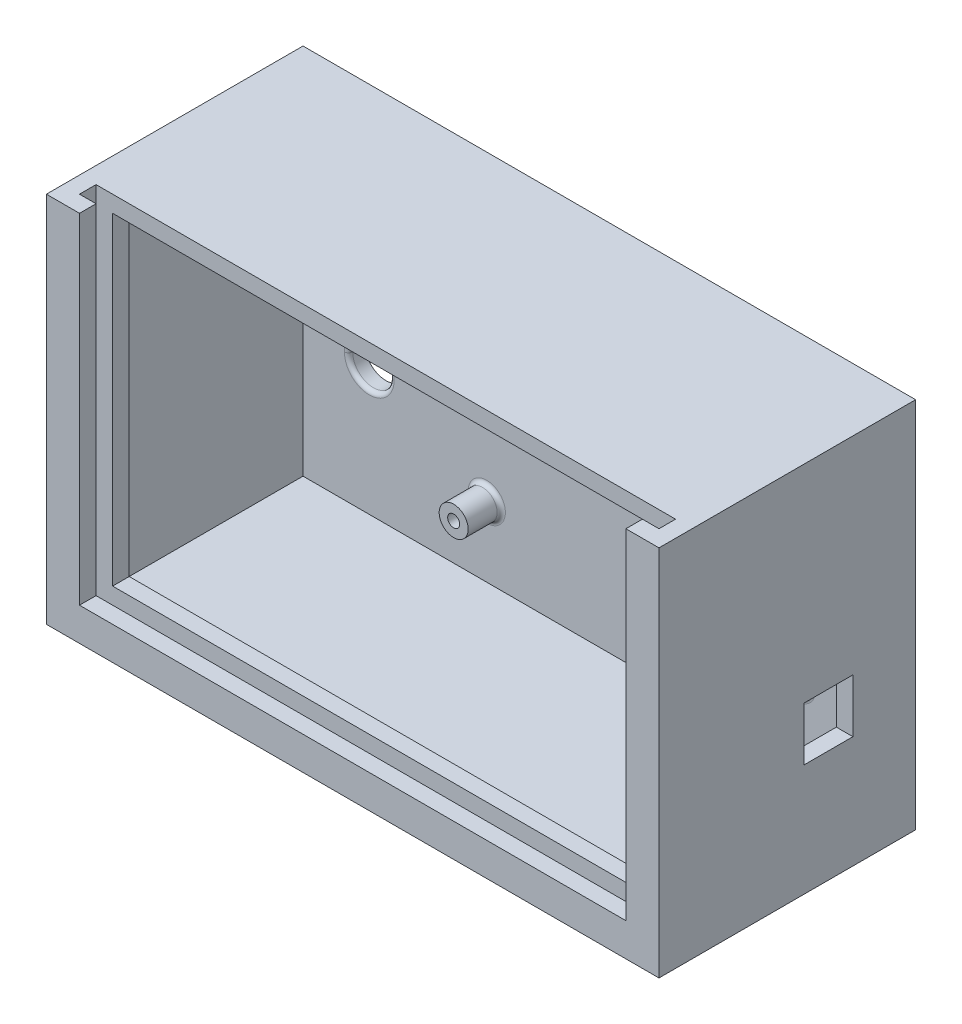
from build123d import *

# Parameters (mm, degrees)
SKETCH1_W                = 148
SKETCH1_H                = 90
BOSS_EXTRUDE1_DEPTH      = 4
SKETCH2_R                = 4
CUT_EXTRUDE1_DEPTH       = 4
SKETCH3_R                = 3.5
SKETCH3_R_2              = 1.45
SKETCH3_R_3              = 3.219945731
BOSS_EXTRUDE2_DEPTH      = 8
CUT_EXTRUDE2_DEPTH       = 10
SKETCH8_W                = 148
SKETCH8_H                = 90
SKETCH8_W_2              = 140
SKETCH8_H_2              = 82
BOSS_EXTRUDE3_DEPTH      = 50
FILLET1_R                = 1
BOSS_EXTRUDE4_DEPTH      = 8
BOSS_EXTRUDE4_DEPTH_BACK = 4
CUT_EXTRUDE3_REACH       = 133.985
SKETCH10_W               = 140
SKETCH10_H               = 4
CUT_EXTRUDE4_REACH       = 165.11
SKETCH11_W               = 11.795
SKETCH11_H               = 12.938


with BuildPart() as part:
    # Sketch1 → Boss-Extrude1 (new body)
    with BuildSketch(Plane.XY):
        Rectangle(SKETCH1_W, SKETCH1_H)
    extrude(amount=BOSS_EXTRUDE1_DEPTH)

    # Sketch2 → Cut-Extrude1 (cut)
    with BuildSketch(Plane.XY.offset(4)):
        with Locations((54, 0)):
            Circle(SKETCH2_R)
        with Locations((14, 0)):
            Circle(SKETCH2_R)
    extrude(amount=-CUT_EXTRUDE1_DEPTH, mode=Mode.SUBTRACT)

    # Sketch3 → Boss-Extrude2 (add)
    # profile 1 of 4: a face of its own
    with BuildSketch(Plane.XY.offset(4)):
        with Locations(Location((-33.0986, 24.1681, 0), (0, 0, 180))):
            Circle(SKETCH3_R)
        with Locations((-33.0986, 24.1681)):
            Circle(SKETCH3_R_2, mode=Mode.SUBTRACT)
    # profile 2 of 4: a face of its own
    with BuildSketch(Plane.XY.offset(4)):
        with Locations(Location((49.5276, 24.1681, 0), (0, 0, 180))):
            Circle(SKETCH3_R)
        with Locations((49.5276, 24.1681)):
            Circle(SKETCH3_R_2, mode=Mode.SUBTRACT)
    # profile 3 of 4: a face of its own
    with BuildSketch(Plane.XY.offset(4)):
        with Locations(Location((-25.6056, -24.1681, 0), (0, 0, 180))):
            Circle(SKETCH3_R)
        with Locations((-25.6056, -24.1681)):
            Circle(SKETCH3_R_2, mode=Mode.SUBTRACT)
    # profile 4 of 4: a face of its own
    with BuildSketch(Plane.XY.offset(4)):
        with Locations(Location((49.5276, -24.1681, 0), (0, 0, 180))):
            Circle(SKETCH3_R_3)
        with Locations((49.5276, -24.1681)):
            Circle(SKETCH3_R_2, mode=Mode.SUBTRACT)
    extrude(amount=BOSS_EXTRUDE2_DEPTH)

    # Sketch7 → Cut-Extrude2 (cut)
    with BuildSketch(Plane.XY.offset(4)):
        with BuildLine():
            Line((-59, -10), (-59, 10))
            ThreePointArc((-59, 10), (-54, 15), (-49, 10))
            Line((-49, 10), (-49, -10))
            ThreePointArc((-49, -10), (-54, -15), (-59, -10))
        make_face()
    extrude(amount=-CUT_EXTRUDE2_DEPTH, mode=Mode.SUBTRACT)

    # Sketch8 → Boss-Extrude3 (add)
    with BuildSketch(Plane.XY.offset(4)):
        Rectangle(SKETCH8_W, SKETCH8_H)
        Rectangle(SKETCH8_W_2, SKETCH8_H_2, mode=Mode.SUBTRACT)
    extrude(amount=BOSS_EXTRUDE3_DEPTH)

    # Fillet1
    fillet1_edges = [part.edges().sort_by_distance(p)[0] for p in [
        (-29.5986, 24.1681, 4),
        (53.0276, 24.1681, 4),
        (-22.1056, -24.1681, 4),
        (52.747545731, -24.1681, 4),
        (-54, -15, 4),
        (-49, 0, 4),
        (-54, 15, 4),
        (-59, 0, 4),
    ]]
    fillet(fillet1_edges, radius=FILLET1_R)

    # Sketch9 → Boss-Extrude4 (add, two sides: drawn at the far end of the back side and taken through both)
    with BuildSketch(Plane.XY.offset(54).offset(-BOSS_EXTRUDE4_DEPTH_BACK)):
        Polygon((-74, 45), (-66, 45), (-66, -37), (66, -37), (66, 45), (74, 45), (74, -45), (66, -45), (-66, -45), (-74, -45), align=None)
    extrude(amount=BOSS_EXTRUDE4_DEPTH + BOSS_EXTRUDE4_DEPTH_BACK)

    # Cut-Extrude3: up to this face of the body (flat: up to its plane)
    cut_extrude3_end = Plane(part.part.faces().sort_by_distance((0, -41, 27))[0])
    # Sketch10 → Cut-Extrude3 (cut, up to the picked face)
    with BuildSketch(Plane(origin=(0, 45, 0), x_dir=(1, 0, 0), z_dir=(0, 1, 0)), mode=Mode.PRIVATE) as cut_extrude3_sk1:
        with Locations((0, -56)):
            Rectangle(SKETCH10_W, SKETCH10_H)
    cut_extrude3_tool1 = split(extrude(cut_extrude3_sk1.sketch, amount=-CUT_EXTRUDE3_REACH, mode=Mode.PRIVATE), bisect_by=cut_extrude3_end, keep=Keep.BOTH, mode=Mode.PRIVATE)
    add(cut_extrude3_tool1.solids().sort_by(Axis((0, 45, 56), (0, -1, 0)))[0], mode=Mode.SUBTRACT)

    # Sketch11 → Cut-Extrude4 (cut, up to next)
    with BuildSketch(Plane.ZY.offset(-70), mode=Mode.PRIVATE) as cut_extrude4_sk1:
        with Locations((21.0485, -11.4681)):
            Rectangle(SKETCH11_W, SKETCH11_H)
    cut_extrude4_tool1 = extrude(cut_extrude4_sk1.sketch, amount=-CUT_EXTRUDE4_REACH, mode=Mode.PRIVATE) & part.part
    add(cut_extrude4_tool1.solids().sort_by_distance((70, -11.4681, 21.0485))[0], mode=Mode.SUBTRACT)


solid = part.part
